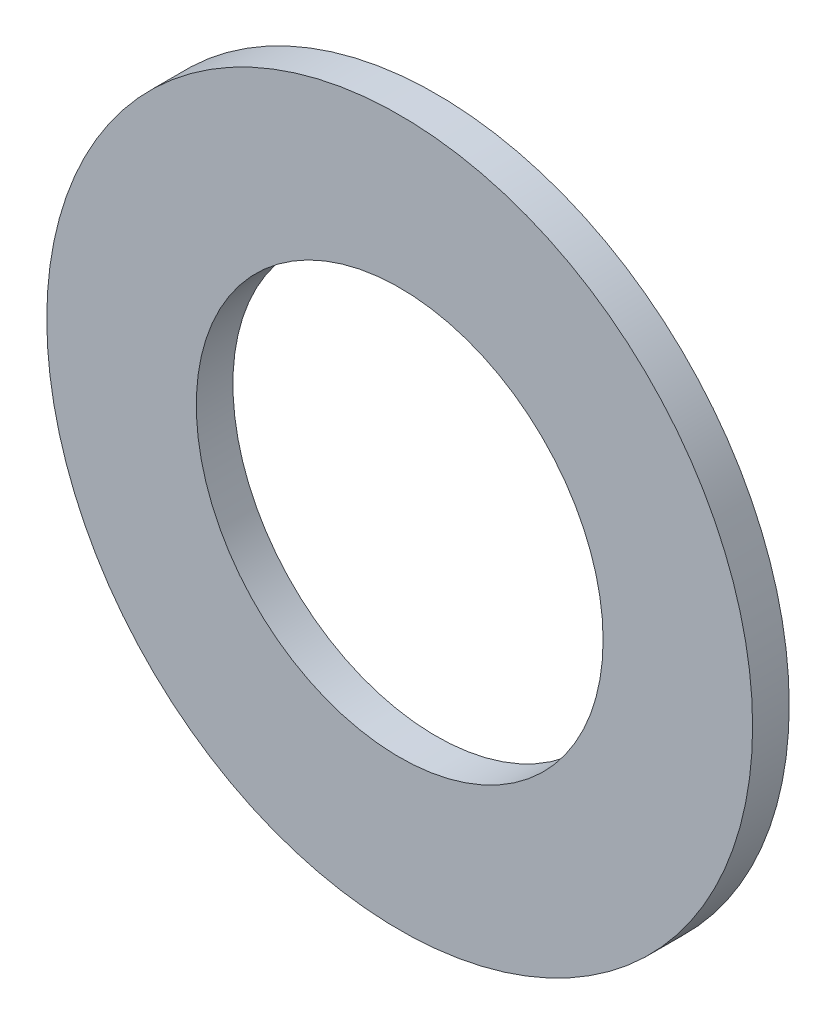
from build123d import *

# Parameters (mm, degrees)
ESQUISSE1_R          = 17.35
ESQUISSE1_R_2        = 10
BASE_EXTRUSION_DEPTH = 1.8


with BuildPart() as part:
    # Esquisse1 → Base-Extrusion (new body)
    with BuildSketch(Plane.XY):
        Circle(ESQUISSE1_R)
        Circle(ESQUISSE1_R_2, mode=Mode.SUBTRACT)
    extrude(amount=BASE_EXTRUSION_DEPTH)


solid = part.part
